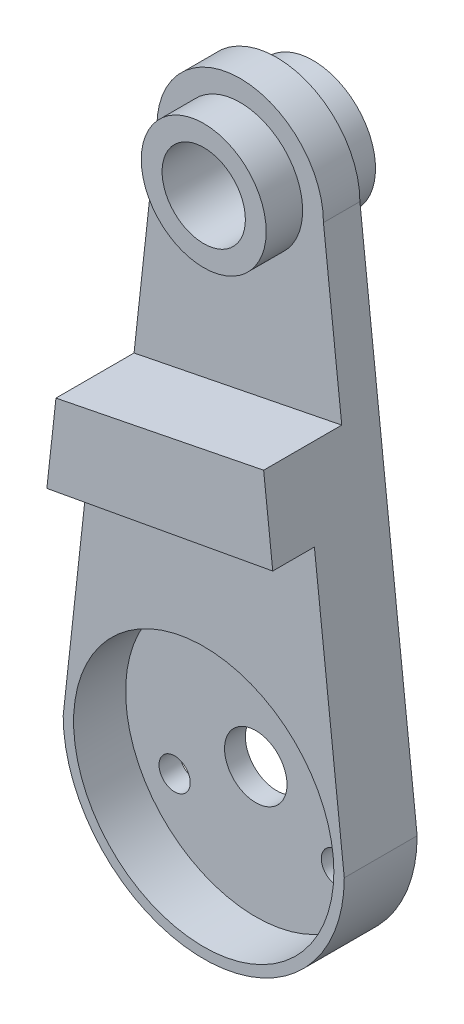
from build123d import *

# Parameters (mm, degrees)
BOSS_EXTRU_1_DEPTH      = 7
ESQUISSE2_R             = 3
ENL_V_MAT_EXTRU_1_DEPTH = 7
ESQUISSE3_R             = 1.5
ENL_V_MAT_EXTRU_2_DEPTH = 7
ESQUISSE5_R             = 12.5
ENL_V_MAT_EXTRU_5_DEPTH = 5
ESQUISSE10_W            = 27
ESQUISSE10_H            = 3.5
ENL_V_MAT_EXTRU_6_DEPTH = 20
ESQUISSE12_R            = 6
BOSS_EXTRU_3_DEPTH      = 3.5
ESQUISSE13_R            = 4
ENL_V_MAT_EXTRU_7_DEPTH = 66.295482233
ENL_V_MAT_EXTRU_8_DEPTH = 3.5
BOSS_EXTRU_4_DEPTH      = 4
ESQUISSE16_R            = 6
ESQUISSE16_R_2          = 4
BOSS_EXTRU_5_DEPTH      = 3.5


with BuildPart() as part:
    # Esquisse1 → Boss.-Extru.1 (new body)
    with BuildSketch(Plane.XY):
        with BuildLine():
            Line((8, 0), (13.5, -50))
            ThreePointArc((13.5, -50), (0, -63.5), (-13.5, -50))
            Line((-13.5, -50), (-8, 0))
            ThreePointArc((-8, 0), (0, 8), (8, 0))
        make_face()
    extrude(amount=BOSS_EXTRU_1_DEPTH)

    # Esquisse2 → Enlèv. mat.-Extru.1 (cut)
    with BuildSketch(Plane.XY.offset(7)):
        with Locations((0, -50)):
            Circle(ESQUISSE2_R)
    extrude(amount=-ENL_V_MAT_EXTRU_1_DEPTH, mode=Mode.SUBTRACT)

    # Esquisse3 → Enlèv. mat.-Extru.2 (cut)
    with BuildSketch(Plane.XY.offset(7)):
        with Locations((0, -41)):
            Circle(ESQUISSE3_R)
        with Locations((-7.794228634, -54.5)):
            Circle(ESQUISSE3_R)
        with Locations((7.794228634, -54.5)):
            Circle(ESQUISSE3_R)
    extrude(amount=-ENL_V_MAT_EXTRU_2_DEPTH, mode=Mode.SUBTRACT)

    # Esquisse5 → Enlèv. mat.-Extru.5 (cut)
    with BuildSketch(Plane.XY.offset(7)):
        with Locations((0, -50)):
            Circle(ESQUISSE5_R)
    extrude(amount=-ENL_V_MAT_EXTRU_5_DEPTH, mode=Mode.SUBTRACT)

    # Esquisse10 → Enlèv. mat.-Extru.6 (cut)
    with BuildSketch(Plane(origin=(0, 10, 0), x_dir=(1, 0, 0), z_dir=(0, 1, 0))):
        with Locations((0, -5.25)):
            Rectangle(ESQUISSE10_W, ESQUISSE10_H)
    extrude(amount=-ENL_V_MAT_EXTRU_6_DEPTH, mode=Mode.SUBTRACT)

    # Esquisse12 → Boss.-Extru.3 (add)
    with BuildSketch(Plane.XY.offset(3.5)):
        with Locations(Location((0, 0, 0), (0, 0, 180))):
            Circle(ESQUISSE12_R)
    extrude(amount=BOSS_EXTRU_3_DEPTH)

    # Esquisse13 → Enlèv. mat.-Extru.7 (cut, through all)
    with BuildSketch(Plane.XY.offset(7)):
        Circle(ESQUISSE13_R)
    extrude(amount=-ENL_V_MAT_EXTRU_7_DEPTH, mode=Mode.SUBTRACT)

    # Esquisse14 → Enlèv. mat.-Extru.8 (cut)
    with BuildSketch(Plane.XY.offset(7)):
        Polygon((-9.1, -10), (-10.193404792, -19.940043559), (9.756042875, -15.964026136), (9.1, -10), align=None)
    extrude(amount=-ENL_V_MAT_EXTRU_8_DEPTH, mode=Mode.SUBTRACT)

    # Esquisse15 → Boss.-Extru.4 (add)
    with BuildSketch(Plane.XY.offset(7)):
        Polygon((-10.193404792, -19.940043559), (9.756042875, -15.964026136), (10.630766708, -23.916060983), (-11.068128625, -27.892078407), align=None)
    extrude(amount=BOSS_EXTRU_4_DEPTH)

    # Esquisse16 → Boss.-Extru.5 (add)
    with BuildSketch(Plane(origin=(0, 0, 0), x_dir=(-1, 0, 0), z_dir=(0, 0, -1))):
        Circle(ESQUISSE16_R)
        with Locations(Location((0, 0, 0), (0, 0, 180))):
            Circle(ESQUISSE16_R_2, mode=Mode.SUBTRACT)
    extrude(amount=BOSS_EXTRU_5_DEPTH)


solid = part.part
